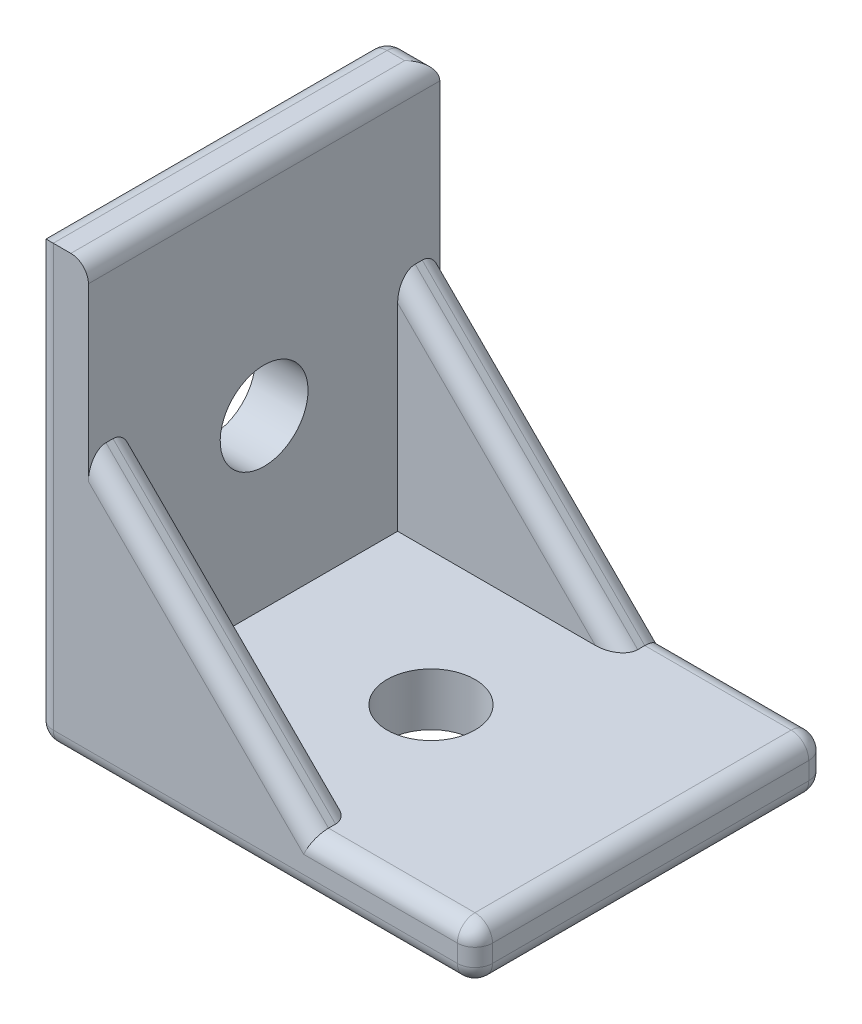
from build123d import *

# Parameters (mm, degrees)
SKETCH1_W           = 25
SKETCH1_H           = 25
BOSS_EXTRUDE1_DEPTH = 20
CUT_EXTRUDE3_START  = -2.4
SKETCH2_W           = 22
SKETCH2_H           = 22
CUT_EXTRUDE3_DEPTH  = 15.2
CUT_EXTRUDE4_DEPTH  = 27.69269563
FILLET1_R           = 1
SKETCH5_R           = 2.5
CUT_EXTRUDE5_DEPTH  = 35.369317712
SKETCH6_R           = 2.5
CUT_EXTRUDE6_DEPTH  = 35.369317712


with BuildPart() as part:
    # Sketch1 → Boss-Extrude1 (new body)
    with BuildSketch(Plane.XY):
        Rectangle(SKETCH1_W, SKETCH1_H)
    extrude(amount=BOSS_EXTRUDE1_DEPTH)

    # Sketch2 → Cut-Extrude3 (cut)
    with BuildSketch(Plane.XY.offset(20).offset(CUT_EXTRUDE3_START)):
        with Locations((1.5, 1.5)):
            Rectangle(SKETCH2_W, SKETCH2_H)
    extrude(amount=-CUT_EXTRUDE3_DEPTH, mode=Mode.SUBTRACT)

    # Sketch3 → Cut-Extrude4 (cut, through all)
    with BuildSketch(Plane.XY.offset(20)):
        Polygon((-9.5, 3.166666667), (3.166666667, -9.5), (12.5, -9.5), (12.5, 12.5), (-9.5, 12.5), align=None)
    extrude(amount=-CUT_EXTRUDE4_DEPTH, mode=Mode.SUBTRACT)

    # Fillet1
    fillet1_edges = [part.edges().sort_by_distance(p)[0] for p in [
        (-12.5, 0, 20),
        (0, -12.5, 20),
        (12.5, -9.5, 10),
        (-9.5, 12.5, 10),
        (-3.166666667, -3.166666667, 17.6),
        (-11, 12.5, 0),
        (-3.166666667, -3.166666667, 2.4),
        (-3.166666667, -3.166666667, 0),
        (7.833333333, -9.5, 20),
        (7.833333333, -9.5, 0),
        (-3.166666667, -3.166666667, 20),
        (12.5, -11, 20),
        (0, -12.5, 0),
        (-12.5, 0, 0),
        (12.5, -11, 0),
        (12.5, -12.5, 10),
        (-12.5, -12.5, 10),
        (-12.5, 12.5, 10),
    ]]
    fillet(fillet1_edges, radius=FILLET1_R)

    # Sketch5 → Cut-Extrude5 (cut, through all)
    with BuildSketch(Plane.XZ.offset(12.5)):
        with Locations(Location((0, 10, 0), (0, 0, 270))):
            Circle(SKETCH5_R)
    extrude(amount=-CUT_EXTRUDE5_DEPTH, mode=Mode.SUBTRACT)

    # Sketch6 → Cut-Extrude6 (cut, through all)
    with BuildSketch(Plane.ZY.offset(12.5)):
        with Locations(Location((10, 0, 0), (0, 0, 270))):
            Circle(SKETCH6_R)
    extrude(amount=-CUT_EXTRUDE6_DEPTH, mode=Mode.SUBTRACT)


solid = part.part
